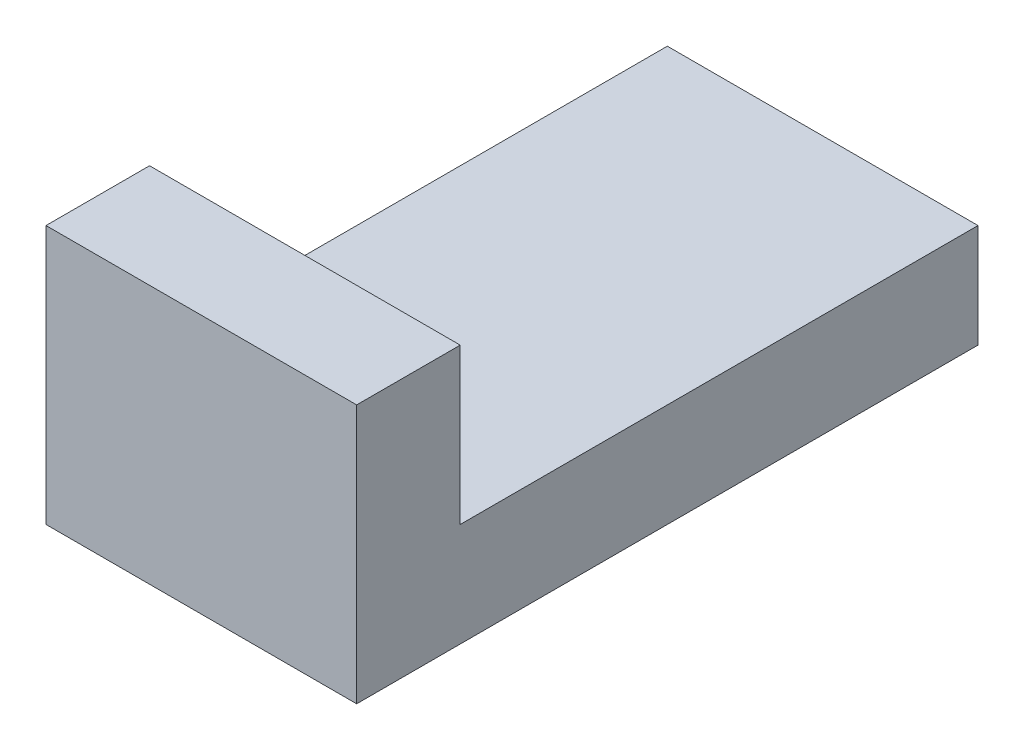
from build123d import *

# Parameters (mm, degrees)
EXTRUDE_THIN1_DEPTH = 15


with BuildPart() as part:
    # Sketch1 → Extrude-Thin1 (new, symmetric)
    with BuildSketch(Plane(origin=(0, 0, 0), x_dir=(0, 0, -1), z_dir=(1, 0, 0))):
        Polygon((0, 25), (0, 0), (60, 0), (60, 10), (10, 10), (10, 25), align=None)
    extrude(amount=EXTRUDE_THIN1_DEPTH, both=True)


solid = part.part
